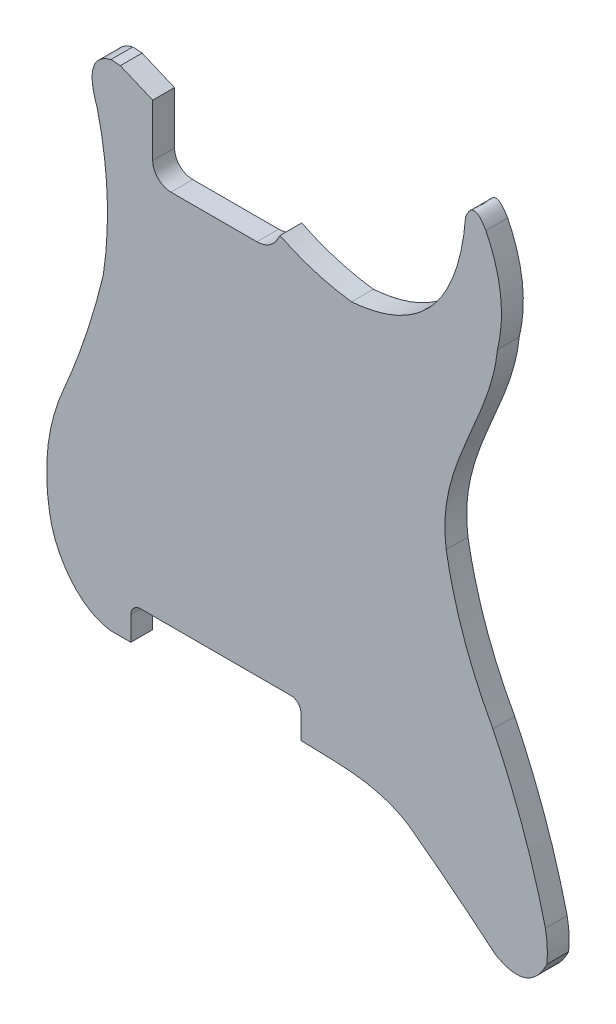
from build123d import *

# Parameters (mm, degrees)
BOSS_EXTRUDE1_DEPTH = 10


with BuildPart() as part:
    # Sketch2 → Boss-Extrude1 (new body)
    with BuildSketch(Plane.XY):
        with BuildLine():
            Line((124.641341211, 54.579558825), (124.641341211, 65.576654529))
            ThreePointArc((124.641341211, 65.576654529), (123.303990774, 68.805304092), (120.075341211, 70.142654529))
            Line((120.075341211, 70.142654529), (51.212390107, 70.142654529))
            ThreePointArc((51.212390107, 70.142654529), (47.983740544, 68.805304092), (46.646390107, 65.576654529))
            Line((46.646390107, 65.576654529), (46.646390107, 54.579558825))
            Line((46.646390107, 54.579558825), (37.522288645, 54.579558825))
            add(Edge.make_bspline(
                [(37.522288645, 54.579558825), (21.959514644, 56.51337661), (11.293168946, 73.672446471), (9.333160981, 87.851570435)],
                knots=[0, 0, 0, 0, 1, 1, 1, 1], degree=3))
            add(Edge.make_bspline(
                [(9.333160981, 87.851570435), (4.816885024, 115.123208654), (16.148817178, 140.412638245)],
                knots=[0, 0, 0, 1, 1, 1], degree=2))
            add(Edge.make_bspline(
                [(16.148817178, 140.412638245), (27.405872479, 166.530361958), (34.0318253, 194.214132047)],
                knots=[0, 0, 0, 1, 1, 1], degree=2))
            add(Edge.make_bspline(
                [(34.0318253, 194.214132047), (38.922769668, 226.832256951), (31.295716129, 258.863919402)],
                knots=[0, 0, 0, 1, 1, 1], degree=2))
            add(Edge.make_bspline(
                [(31.295716129, 258.863919402), (24.342240472, 277.969027169), (37.522288645, 281.482204385)],
                knots=[0, 0, 0, 1, 1, 1], degree=2))
            Line((37.522288645, 281.482204385), (41.820716746, 281.182482064))
            Line((41.820716746, 281.182482064), (56.678211753, 274.911461444))
            Line((56.678211753, 274.911461444), (56.678211753, 250.94461401))
            ThreePointArc((56.678211753, 250.94461401), (59.130020887, 245.025423145), (65.049211753, 242.57361401))
            Line((65.049211753, 242.57361401), (104.457119811, 242.57361401))
            ThreePointArc((104.457119811, 242.57361401), (109.86830274, 244.050097173), (113.779669547, 248.070310218))
            Line((113.779669547, 248.070310218), (115.046074428, 250.359514609))
            add(Edge.make_bspline(
                [(115.046074428, 250.359514609), (130.641476409, 242.603233813), (147.862901343, 240.41980261)],
                knots=[0, 0, 0, 1, 1, 1], degree=2))
            add(Edge.make_bspline(
                [(147.862901343, 240.41980261), (195.584291202, 244.368436644), (200.178603281, 300.299783152)],
                knots=[0, 0, 0, 1, 1, 1], degree=2))
            add(Edge.make_bspline(
                [(200.178603281, 300.299783152), (203.787730837, 309.531782357), (209.479274597, 299.515490412)],
                knots=[0, 0, 0, 1, 1, 1], degree=2))
            add(Edge.make_bspline(
                [(209.479274597, 299.515490412), (220.319872334, 277.449577488), (214.75338425, 254.809889378)],
                knots=[0, 0, 0, 1, 1, 1], degree=2))
            add(Edge.make_bspline(
                [(214.75338425, 254.809889378), (211.622795841, 223.210356753), (186.430957093, 197.647557224), (191.264009323, 163.691313614)],
                knots=[0, 0, 0, 0, 1, 1, 1, 1], degree=3))
            add(Edge.make_bspline(
                [(191.264009323, 163.691313614), (196.854658148, 131.726086499), (212.699126926, 103.238239648)],
                knots=[0, 0, 0, 1, 1, 1], degree=2))
            add(Edge.make_bspline(
                [(212.699126926, 103.238239648), (228.353478754, 71.031768285), (236.75185914, 36.050820835)],
                knots=[0, 0, 0, 1, 1, 1], degree=2))
            add(Edge.make_bspline(
                [(236.75185914, 36.050820835), (238.174984629, 29.048757065), (237.427230612, 22.075105786)],
                knots=[0, 0, 0, 1, 1, 1], degree=2))
            add(Edge.make_bspline(
                [(237.427230612, 22.075105786), (229.298254036, 5.512025134), (213.990313769, 14.041488397)],
                knots=[0, 0, 0, 1, 1, 1], degree=2))
            add(Edge.make_bspline(
                [(213.990313769, 14.041488397), (194.666199965, 30.334432476), (174.369459856, 45.394945883)],
                knots=[0, 0, 0, 1, 1, 1], degree=2))
            add(Edge.make_bspline(
                [(174.369459856, 45.394945883), (159.806078551, 55.078070021), (141.198769972, 53.922244486), (124.641341211, 54.579558825)],
                knots=[0, 0, 0, 0, 1, 1, 1, 1], degree=3))
        make_face()
    extrude(amount=BOSS_EXTRUDE1_DEPTH)


solid = part.part
